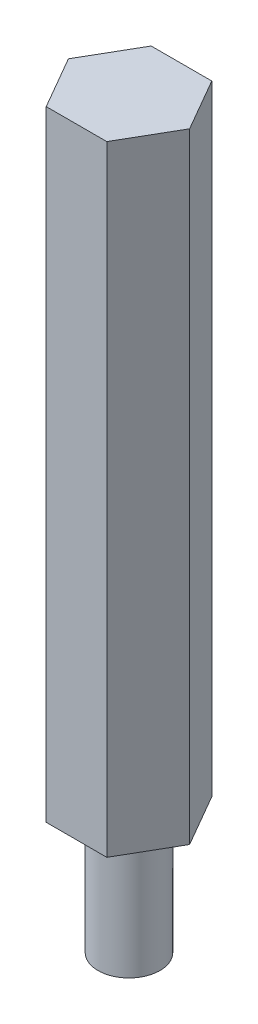
from build123d import *

# Parameters (mm, degrees)
EXTRUDE_1_DEPTH = 30
SKETCH_2_R      = 1.5
EXTRUDE_2_DEPTH = 6


with BuildPart() as part:
    # 스케치1 → 보스-돌출1 (new body)
    with BuildSketch(Plane(origin=(0, 0, 0), x_dir=(1, 0, 0), z_dir=(0, 1, 0))):
        Polygon((1.466469684, 2.54), (-1.466469684, 2.54), (-2.932939367, 0), (-1.466469684, -2.54), (1.466469684, -2.54), (2.932939367, 0), align=None)
    extrude(amount=EXTRUDE_1_DEPTH)

    # 스케치2 → 보스-돌출2 (add)
    with BuildSketch(Plane.XZ):
        with Locations(Location((0, 0, 0), (0, 0, 270))):
            Circle(SKETCH_2_R)
    extrude(amount=EXTRUDE_2_DEPTH)


solid = part.part
